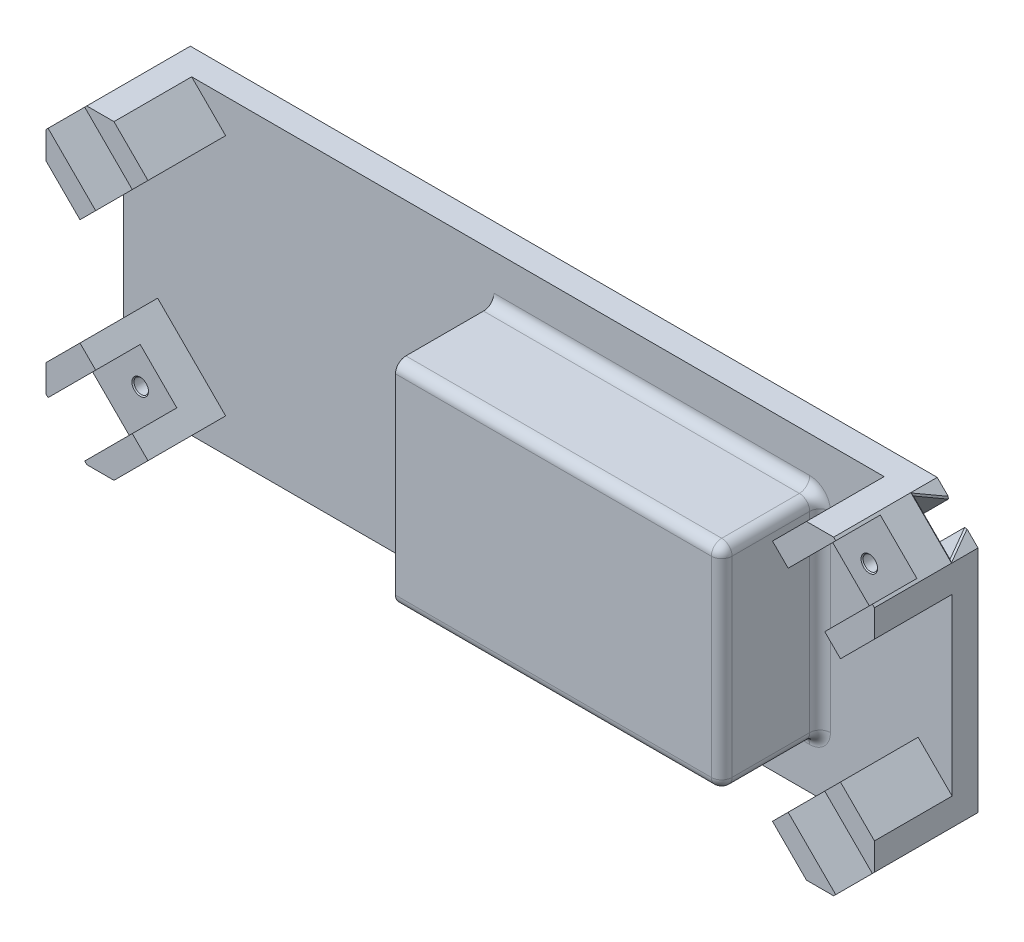
from build123d import *

# Parameters (mm, degrees)
BOSS_EXTRUDE1_DEPTH     = 27.432
BOSS_EXTRUDE2_DEPTH     = 5.08
SKETCH4_R               = 1.524
CUT_EXTRUDE1_DEPTH      = 2.286
SKETCH4_4_R             = 1.524
CUT_EXTRUDE2_DEPTH      = 63.630575033
BOSS_EXTRUDE3_DEPTH     = 3.81
FILLET1_R               = 2.54
CHAMFER3_SIZE           = 1.27
CHAMFER4_SIZE           = 0.254
SKETCH8_W               = 101.6
SKETCH8_H               = 44.45
CUT_EXTRUDE3_DEPTH      = 5.08
CHAMFER5_SIZE           = 1.27
BOSS_EXTRUDE4_DEPTH     = 6.35
FILLET2_R               = 1.27
BOSS_EXTRUDE5_DEPTH     = 19.05
CUT_EXTRUDE4_DEPTH      = 15.24
MIRROR3_COPY_1_DEPTH    = 15.24
CHAMFER7_SIZE           = 0.381
CUT_EXTRUDE6_DEPTH      = 2.54
MIRROR5_COPY_1_DEPTH    = 2.54
CUT_EXTRUDE7_DEPTH      = 10.922
SKETCH18_R              = 1.778
CUT_EXTRUDE8_DEPTH      = 8.382
MIRROR7_COPY_1_SKETCH_R = 1.778
MIRROR7_COPY_1_DEPTH    = 8.382
SKETCH19_W              = 135.869666512
SKETCH19_H              = 67.345799606
CUT_EXTRUDE9_DEPTH      = 31.242
BOSS_EXTRUDE6_DEPTH     = 20.32
SKETCH21_W              = 80.01
SKETCH21_H              = 52.07
BOSS_EXTRUDE7_DEPTH     = 3.81
FILLET3_R               = 2.54
CHAMFER8_SIZE           = 1.27
CHAMFER9_SIZE           = 0.254
CUT_EXTRUDE10_DEPTH     = 3.302
MIRROR9_COPY_1_DEPTH    = 3.302


with BuildPart() as part:
    # Sketch1 → Boss-Extrude1 (new body)
    with BuildSketch(Plane(origin=(10.858740921, 0, 0), x_dir=(1, 0, 0), z_dir=(0, 0, 1))):
        Polygon((-52.705, 25.4), (-52.705, 21.59), (48.895, 21.59), (48.895, -22.86), (-52.705, -22.86), (-52.705, -25.4), (52.705, -25.4), (52.705, 25.4), align=None)
    extrude(amount=BOSS_EXTRUDE1_DEPTH)

    # Sketch1<3> → Boss-Extrude2 (add)
    with BuildSketch(Plane(origin=(10.858740921, 0, 0), x_dir=(1, 0, 0), z_dir=(0, 0, 1))):
        Polygon((48.895, 21.59), (-52.705, 21.59), (-52.705, 13.97), (-6.985, 13.97), (-6.985, -6.35), (-52.705, -6.35), (-52.705, -22.86), (48.895, -22.86), align=None)
    extrude(amount=BOSS_EXTRUDE2_DEPTH)

    # Sketch4 → Cut-Extrude1 (cut)
    # profile 1 of 4: a face of its own
    with BuildSketch(Plane(origin=(10.858740921, 0, 5.08), x_dir=(1, 0, 0), z_dir=(0, 0, 1))):
        Polygon((-44.785877438, 21.59), (-47.924122562, 21.59), (-49.493245123, 18.8722), (-47.924122562, 16.1544), (-44.785877438, 16.1544), (-43.216754877, 18.8722), align=None)
        with Locations((-46.355, 18.8722)):
            Circle(SKETCH4_R, mode=Mode.SUBTRACT)
    # profile 2 of 4: a face of its own
    with BuildSketch(Plane(origin=(10.858740921, 0, 5.08), x_dir=(1, 0, 0), z_dir=(0, 0, 1))):
        Polygon((21.126640721, 16.1544), (17.988395597, 16.1544), (16.419273036, 18.8722), (17.988395597, 21.59), (21.126640721, 21.59), (22.695763282, 18.8722), align=None)
        with Locations((19.557518159, 18.8722)):
            Circle(SKETCH4_R, mode=Mode.SUBTRACT)
    # profile 3 of 4: a face of its own
    with BuildSketch(Plane(origin=(10.858740921, 0, 5.08), x_dir=(1, 0, 0), z_dir=(0, 0, 1))):
        Polygon((22.695763282, -18.8722), (21.126640721, -16.1544), (17.988395597, -16.1544), (16.419273036, -18.8722), (17.988395597, -21.59), (21.126640721, -21.59), align=None)
        with Locations((19.557518159, -18.8722)):
            Circle(SKETCH4_R, mode=Mode.SUBTRACT)
    # profile 4 of 4: a face of its own
    with BuildSketch(Plane(origin=(10.858740921, 0, 5.08), x_dir=(1, 0, 0), z_dir=(0, 0, 1))):
        Polygon((-49.493245123, -18.8722), (-47.924122562, -16.1544), (-44.785877438, -16.1544), (-43.216754877, -18.8722), (-44.785877438, -21.59), (-47.924122562, -21.59), align=None)
        with Locations((-46.355, -18.8722)):
            Circle(SKETCH4_R, mode=Mode.SUBTRACT)
    extrude(amount=-CUT_EXTRUDE1_DEPTH, mode=Mode.SUBTRACT)

    # Sketch4<4> → Cut-Extrude2 (cut, through all)
    with BuildSketch(Plane(origin=(10.858740921, 0, 5.08), x_dir=(1, 0, 0), z_dir=(0, 0, 1))):
        with Locations((-46.355, 18.8722)):
            Circle(SKETCH4_4_R)
        with Locations((19.557518159, 18.8722)):
            Circle(SKETCH4_4_R)
        with Locations((-46.355, -18.8722)):
            Circle(SKETCH4_4_R)
        with Locations((19.557518159, -18.8722)):
            Circle(SKETCH4_4_R)
    extrude(amount=-CUT_EXTRUDE2_DEPTH, mode=Mode.SUBTRACT)

    # Sketch7 → Boss-Extrude3 (add)
    with BuildSketch(Plane(origin=(10.858740921, 0, 27.432), x_dir=(1, 0, 0), z_dir=(0, 0, 1))):
        Polygon((-52.705, 25.4), (52.705, 25.4), (52.705, -25.4), (-52.705, -25.4), (-52.705, -6.35), (-46.355, -6.35), (-46.355, 6.35), (-52.705, 6.35), align=None)
    extrude(amount=BOSS_EXTRUDE3_DEPTH)

    # Fillet1
    fillet1_edges = [part.edges().sort_by_distance(p)[0] for p in [
        (63.563740921, 25.4, 15.621),
        (63.563740921, -25.4, 15.621),
        (10.858740921, -25.4, 31.242),
        (63.563740921, 0, 31.242),
        (10.858740921, 25.4, 31.242),
    ]]
    fillet(fillet1_edges, radius=FILLET1_R)

    # Chamfer3
    chamfer3_edges = [part.edges().sort_by_distance(p)[0] for p in [
        (-41.846259079, 13.97, 27.432),
        (-41.846259079, 6.35, 29.337),
        (-41.846259079, 21.59, 16.256),
        (-41.846259079, -14.605, 27.432),
        (-41.846259079, -6.35, 29.337),
        (-38.671259079, 6.35, 31.242),
        (-35.496259079, 0, 31.242),
        (-38.671259079, -6.35, 31.242),
        (-41.846259079, -22.86, 16.256),
    ]]
    chamfer(chamfer3_edges, length=CHAMFER3_SIZE)

    # Chamfer4
    chamfer4_edges = [part.edges().sort_by_distance(p)[0] for p in [
        (28.892259079, 18.8722, 0),
        (-37.020259079, -18.8722, 0),
        (28.892259079, -18.8722, 0),
        (-37.020259079, 18.8722, 0),
    ]]
    chamfer(chamfer4_edges, length=CHAMFER4_SIZE)

    # Sketch8 → Cut-Extrude3 (cut)
    with BuildSketch(Plane(origin=(10.858740921, 0, 5.08), x_dir=(1, 0, 0), z_dir=(0, 0, 1))):
        with Locations((-1.905, -0.635)):
            Rectangle(SKETCH8_W, SKETCH8_H)
    extrude(amount=-CUT_EXTRUDE3_DEPTH, mode=Mode.SUBTRACT)

    # Chamfer5
    chamfer5_edges = [part.edges().sort_by_distance(p)[0] for p in [
        (-41.846259079, -22.86, 2.54),
        (-41.846259079, 21.59, 2.54),
    ]]
    chamfer(chamfer5_edges, length=CHAMFER5_SIZE)

    # Sketch9 → Boss-Extrude4 (add)
    with BuildSketch(Plane(origin=(10.858740921, 0, 0), x_dir=(-1, 0, 0), z_dir=(0, 0, -1))):
        Polygon((-90.741259079, 28.1), (-80.741259079, 38.1), (102.458740921, 38.1), (112.458740921, 28.1), (112.458740921, -28.1), (102.458740921, -38.1), (-80.741259079, -38.1), (-90.741259079, -28.1), align=None)
    extrude(amount=BOSS_EXTRUDE4_DEPTH)

    # Fillet2
    fillet2_edges = [part.edges().sort_by_distance(p)[0] for p in [
        (9.588740921, -25.4, 0),
        (63.563740921, 0, 0),
        (9.588740921, 25.4, 0),
        (62.819792145, 24.656051224, 0),
        (62.819792145, -24.656051224, 0),
    ]]
    fillet(fillet2_edges, radius=FILLET2_R)

    # Sketch11 → Boss-Extrude5 (add)
    with BuildSketch(Plane.XY):
        Polygon((-101.6, 28.1), (-91.6, 38.1), (-84.925667043, 38.1), (-76.588500564, 29.762833521), (-93.262833521, 13.088500564), (-101.6, 21.425667043), align=None)
        Polygon((84.925667043, 38.1), (76.588500564, 29.762833521), (93.262833521, 13.088500564), (101.6, 21.425667043), (101.6, 28.1), (91.6, 38.1), align=None)
        Polygon((91.6, -38.1), (84.925667043, -38.1), (76.588500564, -29.762833521), (93.262833521, -13.088500564), (101.6, -21.425667043), (101.6, -28.1), align=None)
        Polygon((-84.925667043, -38.1), (-76.588500564, -29.762833521), (-93.262833521, -13.088500564), (-101.6, -21.425667043), (-101.6, -28.1), (-91.6, -38.1), align=None)
    extrude(amount=BOSS_EXTRUDE5_DEPTH)

    # Sketch13 → Cut-Extrude4 (cut)
    with BuildSketch(Plane(origin=(-64.85, 64.85, 0), x_dir=(0, 0, 1), z_dir=(-0.7071067811865477, 0.7071067811865474, 0))):
        Polygon((-6.35, -44.901280605), (-6.35, -42.070807846), (-0.254, -38.551280605), (-0.254, -51.251280605), (-6.35, -47.731753364), align=None)
    cut_extrude4 = extrude(amount=-CUT_EXTRUDE4_DEPTH, mode=Mode.SUBTRACT)

    # Mirror2: Cut-Extrude4 across plane
    add(cut_extrude4.mirror(Plane.ZX), mode=Mode.SUBTRACT)

    # Mirror3: Cut-Extrude4 across plane
    add(cut_extrude4.mirror(Plane(origin=(0, 0, 0), x_dir=(0, 0, 1), z_dir=(1, 0, 0))), mode=Mode.SUBTRACT)

    # Mirror3 copy 1 sketch → Mirror3 copy 1 (cut)
    with BuildSketch(Plane(origin=(64.85, -64.85, 0), x_dir=(0, 0, 1), z_dir=(0.7071067811865477, -0.7071067811865474, 0))):
        Polygon((-6.35, -44.901280605), (-6.35, -42.070807846), (-0.254, -38.551280605), (-0.254, -51.251280605), (-6.35, -47.731753364), align=None)
    extrude(amount=-MIRROR3_COPY_1_DEPTH, mode=Mode.SUBTRACT)

    # Chamfer7
    chamfer7_edges = [part.edges().sort_by_distance(p)[0] for p in [
        (-99.845787271, 29.854212729, -3.302),
        (-96.6, 33.1, -0.254),
        (-93.354212729, 36.345787271, -3.302),
        (-99.845787271, -29.854212729, -3.302),
        (-96.6, -33.1, -0.254),
        (-93.354212729, -36.345787271, -3.302),
        (99.845787271, 29.854212729, -3.302),
        (96.6, 33.1, -0.254),
        (93.354212729, 36.345787271, -3.302),
        (99.845787271, -29.854212729, -3.302),
        (96.6, -33.1, -0.254),
        (93.354212729, -36.345787271, -3.302),
    ]]
    chamfer(chamfer7_edges, length=CHAMFER7_SIZE)

    # Sketch16 → Cut-Extrude6 (cut)
    with BuildSketch(Plane(origin=(0, 0, -6.35), x_dir=(-1, 0, 0), z_dir=(0, 0, -1))):
        Polygon((71.096072616, 17.294749227), (73.790149452, 19.988826063), (83.488826063, 10.290149452), (80.794749227, 7.596072616), align=None)
    cut_extrude6 = extrude(amount=-CUT_EXTRUDE6_DEPTH, mode=Mode.SUBTRACT)

    # Mirror4: Cut-Extrude6 across plane
    add(cut_extrude6.mirror(Plane.ZX), mode=Mode.SUBTRACT)

    # Mirror5: Cut-Extrude6 across plane
    add(cut_extrude6.mirror(Plane(origin=(0, 0, 0), x_dir=(0, 0, 1), z_dir=(1, 0, 0))), mode=Mode.SUBTRACT)

    # Mirror5 copy 1 sketch → Mirror5 copy 1 (cut)
    with BuildSketch(Plane(origin=(0, 0, -6.35), x_dir=(1, 0, 0), z_dir=(0, 0, -1))):
        Polygon((71.096072616, 17.294749227), (73.790149452, 19.988826063), (83.488826063, 10.290149452), (80.794749227, 7.596072616), align=None)
    extrude(amount=-MIRROR5_COPY_1_DEPTH, mode=Mode.SUBTRACT)

    # Sketch17 → Cut-Extrude7 (cut)
    with BuildSketch(Plane.XY.offset(19.05)):
        Polygon((-96.6, 33.1), (-92.109871939, 37.590128061), (-80.435538982, 25.915795103), (-89.415795103, 16.935538982), (-101.090128061, 28.609871939), align=None)
        Polygon((-80.435538982, -25.915795103), (-89.415795103, -16.935538982), (-101.090128061, -28.609871939), (-96.6, -33.1), (-92.109871939, -37.590128061), align=None)
        Polygon((92.109871939, -37.590128061), (80.435538982, -25.915795103), (89.415795103, -16.935538982), (101.090128061, -28.609871939), (96.6, -33.1), align=None)
        Polygon((80.435538982, 25.915795103), (89.415795103, 16.935538982), (101.090128061, 28.609871939), (96.6, 33.1), (92.109871939, 37.590128061), align=None)
    extrude(amount=-CUT_EXTRUDE7_DEPTH, mode=Mode.SUBTRACT)

    # Sketch18 → Cut-Extrude8 (cut)
    with BuildSketch(Plane.XY.offset(8.128)):
        with Locations((-89.415795103, 25.915795103)):
            Circle(SKETCH18_R)
    cut_extrude8 = extrude(amount=-CUT_EXTRUDE8_DEPTH, mode=Mode.SUBTRACT)

    # Mirror6: Cut-Extrude8 across plane
    add(cut_extrude8.mirror(Plane.ZX), mode=Mode.SUBTRACT)

    # Mirror7: Cut-Extrude8 across plane
    add(cut_extrude8.mirror(Plane(origin=(0, 0, 0), x_dir=(0, 0, 1), z_dir=(1, 0, 0))), mode=Mode.SUBTRACT)

    # Mirror7 copy 1 sketch → Mirror7 copy 1 (cut)
    with BuildSketch(Plane(origin=(0, 0, 8.128), x_dir=(-1, 0, 0), z_dir=(0, 0, 1))):
        with Locations((-89.415795103, 25.915795103)):
            Circle(MIRROR7_COPY_1_SKETCH_R)
    extrude(amount=-MIRROR7_COPY_1_DEPTH, mode=Mode.SUBTRACT)

    # Sketch19 → Cut-Extrude9 (cut)
    with BuildSketch(Plane.XY.offset(31.242)):
        Rectangle(SKETCH19_W, SKETCH19_H)
    extrude(amount=-CUT_EXTRUDE9_DEPTH, mode=Mode.SUBTRACT)

    # Sketch20 → Boss-Extrude6 (add)
    with BuildSketch(Plane.XY):
        Polygon((65.405, 22.86), (65.405, -21.59), (-10.795, -21.59), (-10.795, -25.4), (69.215, -25.4), (69.215, 26.67), (-10.795, 26.67), (-10.795, 22.86), align=None)
    extrude(amount=BOSS_EXTRUDE6_DEPTH)

    # Sketch21 → Boss-Extrude7 (add)
    with BuildSketch(Plane.XY.offset(20.32)):
        with Locations((29.21, 0.635)):
            Rectangle(SKETCH21_W, SKETCH21_H)
    extrude(amount=BOSS_EXTRUDE7_DEPTH)

    # Fillet3
    fillet3_edges = [part.edges().sort_by_distance(p)[0] for p in [
        (29.21, -25.4, 0),
        (69.215, 0.635, 0),
        (69.215, -25.4, 12.065),
        (29.21, 26.67, 0),
        (69.215, 26.67, 12.065),
        (29.21, -25.4, 24.13),
        (69.215, 0.635, 24.13),
        (29.21, 26.67, 24.13),
    ]]
    fillet(fillet3_edges, radius=FILLET3_R)

    # Chamfer8
    chamfer8_edges = [part.edges().sort_by_distance(p)[0] for p in [
        (-10.795, 22.86, 10.16),
        (-10.795, -21.59, 10.16),
        (-10.795, 0.635, 20.32),
    ]]
    chamfer(chamfer8_edges, length=CHAMFER8_SIZE)

    # Chamfer9
    chamfer9_edges = [part.edges().sort_by_distance(p)[0] for p in [
        (-91.193795103, 25.915795103, 8.128),
        (-91.193795103, -25.915795103, 8.128),
        (91.193795103, 25.915795103, 8.128),
        (91.193795103, -25.915795103, 8.128),
    ]]
    chamfer(chamfer9_edges, length=CHAMFER9_SIZE)

    # Sketch22 → Cut-Extrude10 (cut)
    with BuildSketch(Plane(origin=(0, 0, -0.254), x_dir=(-1, 0, 0), z_dir=(0, 0, -1))):
        Polygon((-85.016386052, -25.915795103), (-87.216090578, -22.105795103), (-91.615499629, -22.105795103), (-93.815204154, -25.915795103), (-91.615499629, -29.725795103), (-87.216090578, -29.725795103), align=None)
    cut_extrude10 = extrude(amount=-CUT_EXTRUDE10_DEPTH, mode=Mode.SUBTRACT)

    # Mirror8: Cut-Extrude10 across plane
    add(cut_extrude10.mirror(Plane.ZX), mode=Mode.SUBTRACT)

    # Mirror9: Cut-Extrude10 across plane
    add(cut_extrude10.mirror(Plane(origin=(0, 0, 0), x_dir=(0, 0, 1), z_dir=(1, 0, 0))), mode=Mode.SUBTRACT)

    # Mirror9 copy 1 sketch → Mirror9 copy 1 (cut)
    with BuildSketch(Plane(origin=(0, 0, -0.254), x_dir=(1, 0, 0), z_dir=(0, 0, -1))):
        Polygon((-85.016386052, -25.915795103), (-87.216090578, -22.105795103), (-91.615499629, -22.105795103), (-93.815204154, -25.915795103), (-91.615499629, -29.725795103), (-87.216090578, -29.725795103), align=None)
    extrude(amount=-MIRROR9_COPY_1_DEPTH, mode=Mode.SUBTRACT)


solid = part.part
